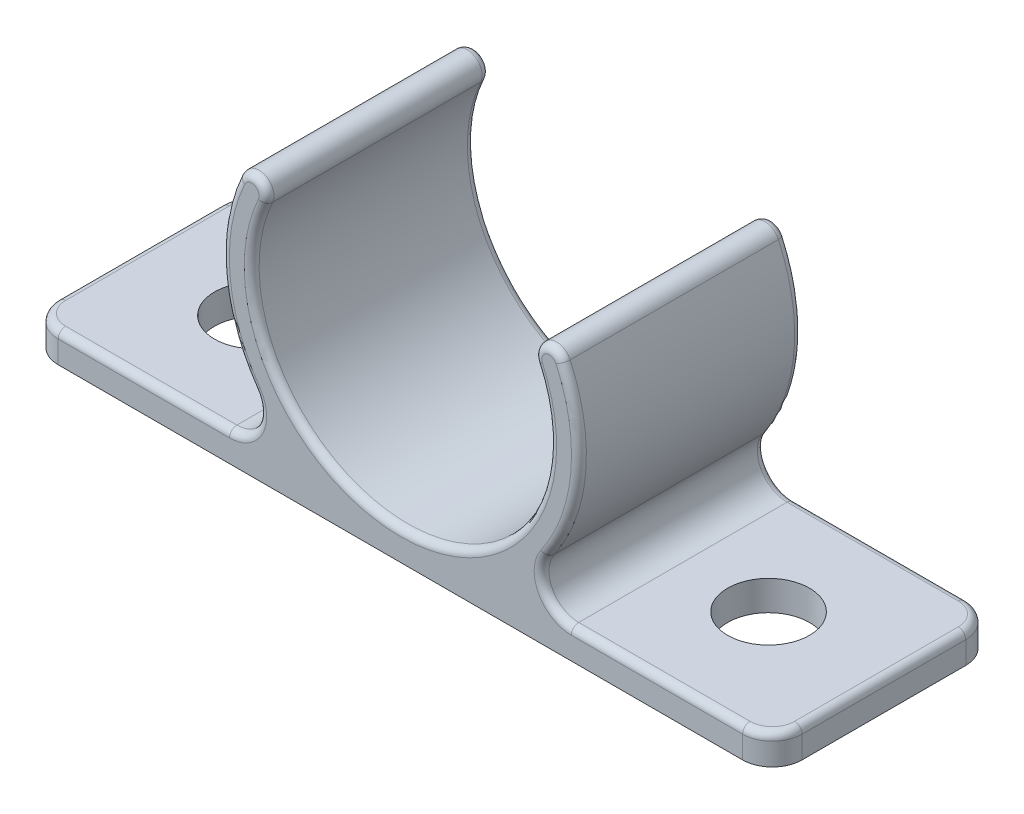
from build123d import *

# Parameters (mm, degrees)
BOSS_EXTRUDE1_DEPTH  = 15
FILLET1_R            = 2
FILLET2_R            = 0.5
M5_CLEARANCE_HOLE1_D = 5.5


with BuildPart() as part:
    # Sketch1 → Boss-Extrude1 (new body)
    with BuildSketch(Plane.XY):
        with BuildLine():
            Line((6.633249581, -10), (25, -10))
            Line((25, -10), (25, -12))
            Line((25, -12), (-25, -12))
            Line((-25, -12), (-25, -10))
            Line((-25, -10), (-6.633249581, -10))
            ThreePointArc((-6.633249581, -10), (-11.540243879, -3.289798052), (-10.909090909, 4.999173485))
            ThreePointArc((-10.909090909, 4.999173485), (-9.58340221, 5.491666604), (-9.090909091, 4.165977905))
            ThreePointArc((-9.090909091, 4.165977905), (0, -10), (9.090909091, 4.165977905))
            ThreePointArc((9.090909091, 4.165977905), (9.58340221, 5.491666604), (10.909090909, 4.999173485))
            ThreePointArc((10.909090909, 4.999173485), (11.540243879, -3.289798052), (6.633249581, -10))
        make_face()
    extrude(amount=BOSS_EXTRUDE1_DEPTH)

    # Fillet1
    fillet1_edges = [part.edges().sort_by_distance(p)[0] for p in [
        (25, -11, 0),
        (-25, -11, 0),
        (6.633249581, -10, 7.5),
        (-6.633249581, -10, 7.5),
        (-25, -11, 15),
        (25, -11, 15),
    ]]
    fillet(fillet1_edges, radius=FILLET1_R)

    # Fillet2
    fillet2_edges = [part.edges().sort_by_distance(p)[0] for p in [
        (-11.952213785, -1.069853093, 0),
        (-9.58340221, 5.491666604, 15),
        (-9.58340221, 5.491666604, 0),
        (0, -10, 0),
        (9.58340221, 5.491666604, 0),
        (-11.952213785, -1.069853093, 15),
        (25, -10, 7.5),
        (17.244562647, -10, 0),
        (17.244562647, -10, 15),
        (24.414213562, -10, 14.414213562),
        (24.414213562, -10, 0.585786438),
        (11.952213785, -1.069853093, 0),
        (-17.244562647, -10, 0),
        (-17.244562647, -10, 15),
        (11.952213785, -1.069853093, 15),
        (-25, -10, 7.5),
        (-24.414213562, -10, 14.414213562),
        (-24.414213562, -10, 0.585786438),
        (-9.716314772, -8.9258201, 0),
        (-9.716314772, -8.9258201, 15),
        (9.716314772, -8.9258201, 0),
        (9.716314772, -8.9258201, 15),
        (9.58340221, 5.491666604, 15),
        (0, -10, 15),
    ]]
    fillet(fillet2_edges, radius=FILLET2_R)

    # M5 Clearance Hole1 (through all)
    with Locations(Plane(origin=(0, -10, 0), x_dir=(1, 0, 0), z_dir=(0, 1, 0))):
        with Locations((-17.244562647, -7.5), (17.244562647, -7.5)):
            Hole(M5_CLEARANCE_HOLE1_D / 2)


solid = part.part
